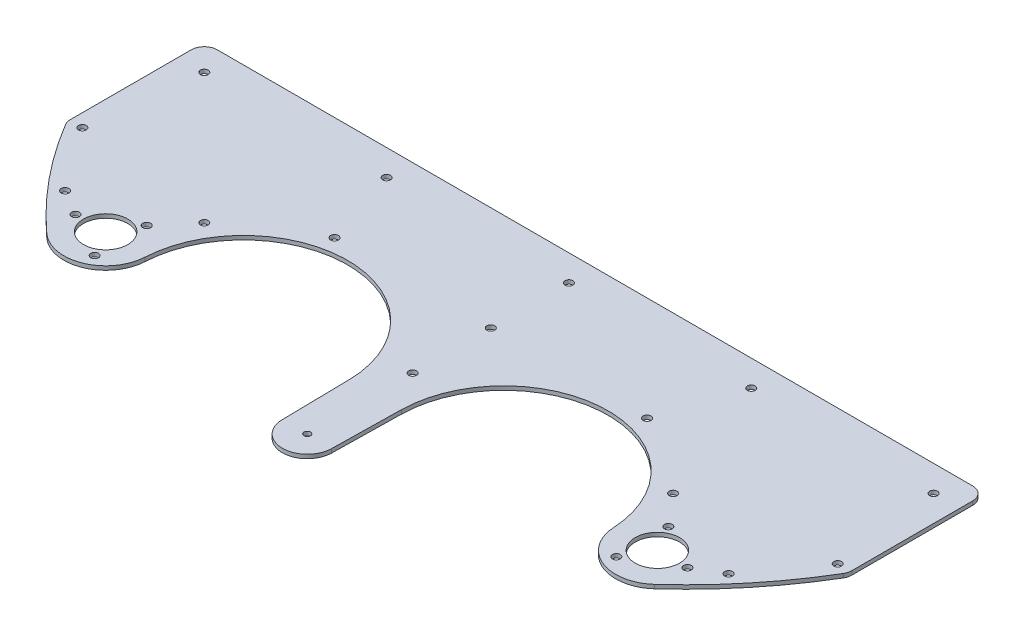
from build123d import *

# Parameters (mm, degrees)
ESQUISSE1_R        = 1.5
ESQUISSE1_R_2      = 8.5
ESQUISSE1_R_3      = 1.25
BOSS_EXTRU_1_DEPTH = 1.5
CONG_1_R           = 5


with BuildPart() as part:
    # Esquisse1 → Boss.-Extru.1 (new body)
    with BuildSketch(Plane(origin=(0, 0, 0), x_dir=(1, 0, 0), z_dir=(0, 1, 0))):
        with BuildLine():
            Line((-150, -35), (150, -35))
            Line((150, -35), (150, -87.757984761))
            ThreePointArc((150, -87.757984761), (134.899573158, -109.560800704), (116.657363934, -128.81196889))
            ThreePointArc((116.657363934, -128.81196889), (99.830836188, -131.749824312), (89.940729359, -117.823273505))
            ThreePointArc((89.940729359, -117.823273505), (49.2602069, -80.006841758), (10.006092194, -119.301903743))
            Line((10.006092194, -119.301903743), (9.546735179, -145.618449467))
            ThreePointArc((9.546735179, -145.618449467), (0, -155), (-9.546735179, -145.618449467))
            Line((-9.546735179, -145.618449467), (-10.006092194, -119.301903743))
            ThreePointArc((-10.006092194, -119.301903743), (-49.2602069, -80.006841758), (-89.940729359, -117.823273505))
            ThreePointArc((-89.940729359, -117.823273505), (-99.830836188, -131.749824312), (-116.657363934, -128.81196889))
            ThreePointArc((-116.657363934, -128.81196889), (-134.899573158, -109.560800704), (-150, -87.757984761))
            Line((-150, -87.757984761), (-150, -35))
        make_face()
        with Locations(Location((-70, -45, 0), (0, 0, 270))):
            Circle(ESQUISSE1_R, mode=Mode.SUBTRACT)
        with Locations(Location((0, -45, 0), (0, 0, 270))):
            Circle(ESQUISSE1_R, mode=Mode.SUBTRACT)
        with Locations(Location((105.917021103, -116.952582907, 0), (0, 0, 90))):
            Circle(ESQUISSE1_R_2, mode=Mode.SUBTRACT)
        with Locations(Location((-105.917021103, -116.952582907, 0), (0, 0, 270))):
            Circle(ESQUISSE1_R_2, mode=Mode.SUBTRACT)
        with Locations(Location((-100.143518411, -106.952582907, 0), (0, 0, 270))):
            Circle(ESQUISSE1_R, mode=Mode.SUBTRACT)
        with Locations(Location((70, -45, 0), (0, 0, 90))):
            Circle(ESQUISSE1_R, mode=Mode.SUBTRACT)
        with Locations(Location((-100.143518411, -126.952582907, 0), (0, 0, 270))):
            Circle(ESQUISSE1_R, mode=Mode.SUBTRACT)
        with Locations(Location((-117.464026487, -116.952582907, 0), (0, 0, 270))):
            Circle(ESQUISSE1_R, mode=Mode.SUBTRACT)
        with Locations(Location((100.143518411, -126.952582907, 0), (0, 0, 90))):
            Circle(ESQUISSE1_R, mode=Mode.SUBTRACT)
        with Locations(Location((117.464026487, -116.952582907, 0), (0, 0, 90))):
            Circle(ESQUISSE1_R, mode=Mode.SUBTRACT)
        with Locations(Location((-140, -45, 0), (0, 0, 270))):
            Circle(ESQUISSE1_R, mode=Mode.SUBTRACT)
        with Locations(Location((140, -45, 0), (0, 0, 90))):
            Circle(ESQUISSE1_R, mode=Mode.SUBTRACT)
        with Locations(Location((100.143518411, -106.952582907, 0), (0, 0, 90))):
            Circle(ESQUISSE1_R, mode=Mode.SUBTRACT)
        with Locations(Location((0, -145.451810585, 0), (0, 0, 270))):
            Circle(ESQUISSE1_R_3, mode=Mode.SUBTRACT)
        with Locations(Location((-60, -75, 0), (0, 0, 270))):
            Circle(ESQUISSE1_R, mode=Mode.SUBTRACT)
        with Locations(Location((-90, -95, 0), (0, 0, 270))):
            Circle(ESQUISSE1_R, mode=Mode.SUBTRACT)
        with Locations(Location((90, -95, 0), (0, 0, 90))):
            Circle(ESQUISSE1_R, mode=Mode.SUBTRACT)
        with Locations(Location((60, -75, 0), (0, 0, 90))):
            Circle(ESQUISSE1_R, mode=Mode.SUBTRACT)
        with Locations(Location((0, -105, 0), (0, 0, 270))):
            Circle(ESQUISSE1_R, mode=Mode.SUBTRACT)
        with Locations(Location((0, -75, 0), (0, 0, 270))):
            Circle(ESQUISSE1_R, mode=Mode.SUBTRACT)
        with Locations(Location((145, -86.810137657, 0), (0, 0, 270))):
            Circle(ESQUISSE1_R, mode=Mode.SUBTRACT)
        with Locations(Location((127.366151897, -111.0804364, 0), (0, 0, 270))):
            Circle(ESQUISSE1_R, mode=Mode.SUBTRACT)
        with Locations(Location((-127.366151897, -111.0804364, 0), (0, 0, 90))):
            Circle(ESQUISSE1_R, mode=Mode.SUBTRACT)
        with Locations(Location((-145, -86.810137657, 0), (0, 0, 90))):
            Circle(ESQUISSE1_R, mode=Mode.SUBTRACT)
    extrude(amount=BOSS_EXTRU_1_DEPTH)

    # Congé1
    cong_1_edges = [part.edges().sort_by_distance(p)[0] for p in [
        (-150, 0.75, 35),
        (150, 0.75, 35),
        (150, 0.75, 87.757984761),
        (-150, 0.75, 87.757984761),
    ]]
    fillet(cong_1_edges, radius=CONG_1_R)


solid = part.part
